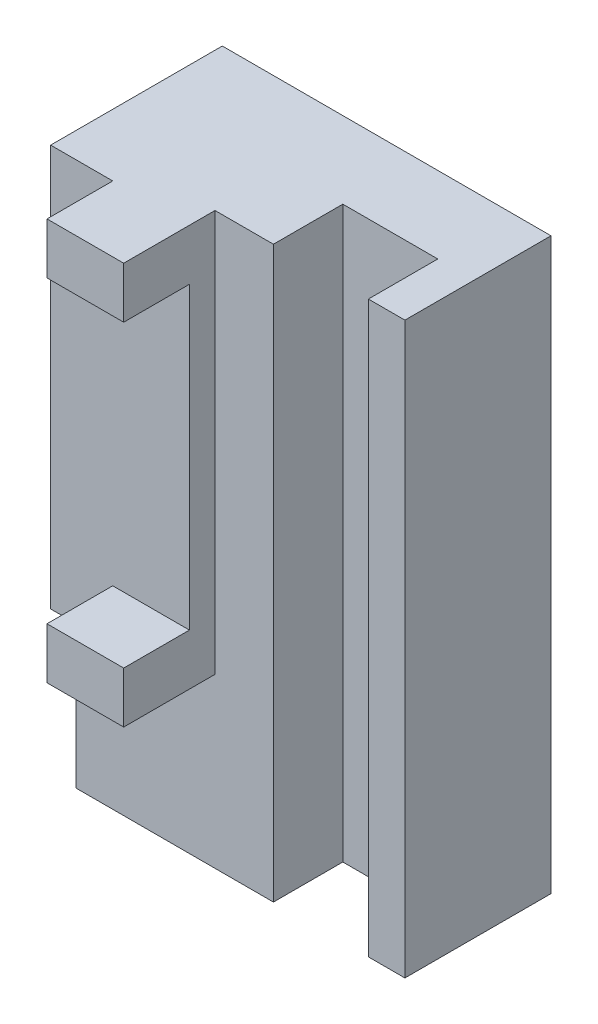
from build123d import *

# Parameters (mm, degrees)
SKETCH4_W           = 45
SKETCH4_H           = 78
BOSS_EXTRUDE1_DEPTH = 20
SKETCH6_W           = 13
SKETCH6_H           = 9.5
CUT_EXTRUDE1_DEPTH  = 86.511276786
SKETCH7_W           = 10.5
SKETCH7_H           = 55
BOSS_EXTRUDE2_DEPTH = 3.5
SKETCH8_W           = 10.5
SKETCH8_H           = 7
BOSS_EXTRUDE3_DEPTH = 9
SKETCH9_W           = 8.5
SKETCH9_H           = 55
BOSS_EXTRUDE4_DEPTH = 3.5


with BuildPart() as part:
    # Sketch4 → Boss-Extrude1 (new body)
    with BuildSketch(Plane.XY):
        with Locations((-6.278089888, 16.575842697)):
            Rectangle(SKETCH4_W, SKETCH4_H)
    extrude(amount=BOSS_EXTRUDE1_DEPTH)

    # Sketch6 → Cut-Extrude1 (cut, through all)
    with BuildSketch(Plane.XZ.offset(22.424157303)):
        with Locations((4.721910112, 15.25)):
            Rectangle(SKETCH6_W, SKETCH6_H)
    extrude(amount=-CUT_EXTRUDE1_DEPTH, mode=Mode.SUBTRACT)

    # Sketch7 → Boss-Extrude2 (add)
    with BuildSketch(Plane.XY.offset(20)):
        with Locations((-15.028089888, 28.075842697)):
            Rectangle(SKETCH7_W, SKETCH7_H)
    extrude(amount=BOSS_EXTRUDE2_DEPTH)

    # Sketch8 → Boss-Extrude3 (add)
    with BuildSketch(Plane.XY.offset(23.5)):
        with Locations((-15.028089888, 4.075842697)):
            Rectangle(SKETCH8_W, SKETCH8_H)
        with Locations((-15.028089888, 52.075842697)):
            Rectangle(SKETCH8_W, SKETCH8_H)
    extrude(amount=BOSS_EXTRUDE3_DEPTH)

    # Sketch9 → Boss-Extrude4 (add)
    with BuildSketch(Plane.XY.offset(20)):
        with Locations((-24.528089888, 28.075842697)):
            Rectangle(SKETCH9_W, SKETCH9_H)
    extrude(amount=BOSS_EXTRUDE4_DEPTH)


solid = part.part
